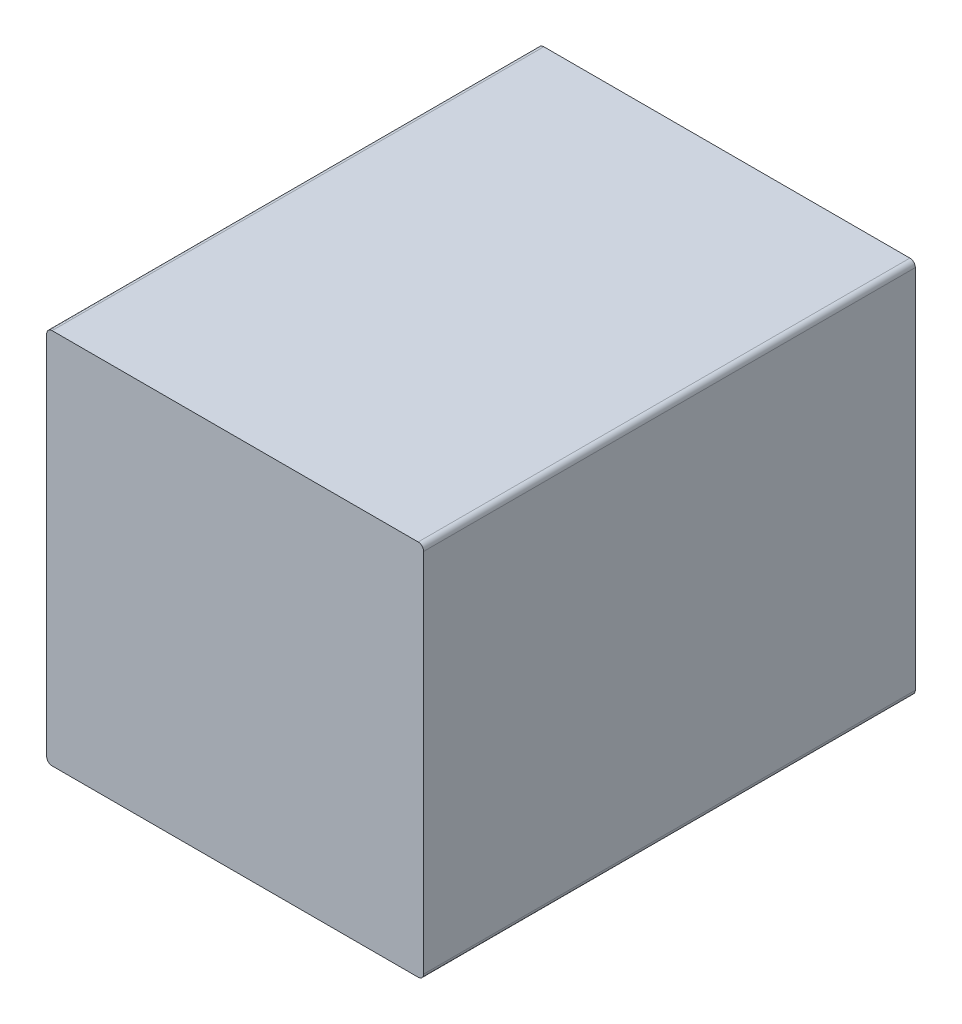
from build123d import *

# Parameters (mm, degrees)
EXTRUDE_START     = 11.8
EXTRUDE_0_5_DEPTH = 45


with BuildPart() as part:
    # 草图1 → 连续直线装板扫掠_带0.5余量 (new body)
    with BuildSketch(Plane.XY.offset(EXTRUDE_START)):
        with BuildLine():
            Line((-16.75, -17.25), (16.75, -17.25))
            ThreePointArc((16.75, -17.25), (17.103553391, -17.103553391), (17.25, -16.75))
            Line((17.25, -16.75), (17.25, 16.75))
            ThreePointArc((17.25, 16.75), (17.103553391, 17.103553391), (16.75, 17.25))
            Line((16.75, 17.25), (-16.75, 17.25))
            ThreePointArc((-16.75, 17.25), (-17.103553391, 17.103553391), (-17.25, 16.75))
            Line((-17.25, 16.75), (-17.25, -16.75))
            ThreePointArc((-17.25, -16.75), (-17.103553391, -17.103553391), (-16.75, -17.25))
        make_face()
    extrude(amount=EXTRUDE_0_5_DEPTH)


solid = part.part
